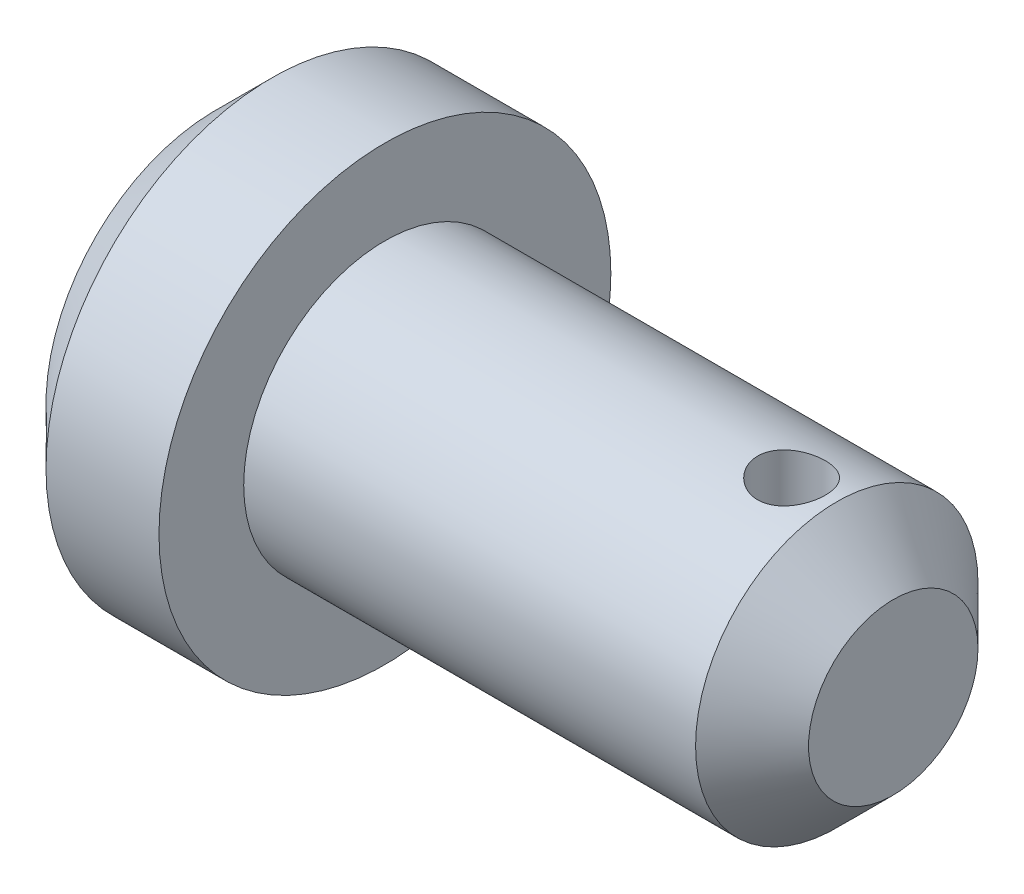
from build123d import *

# Parameters (mm, degrees)
SKETCH_2_W = 6
SKETCH_2_H = 84


with BuildPart() as part:
    # 草圖1 → 迴轉1 (revolve)
    with BuildSketch(Plane.XY, mode=Mode.PRIVATE) as revolve_1_sk:
        Polygon((0, 0), (-120, 0), (-120, 30), (-110, 40), (-90, 40), (-90, 25), (-10, 25), (0, 15), align=None)
    revolve(revolve_1_sk.sketch.rotate(Axis((0, 0, 0), (-1, 0, 0)), 90), axis=Axis((0, 0, 0), (-1, 0, 0)))

    # 草圖2 → 迴轉2 (revolve, cut)
    with BuildSketch(Plane.XY, mode=Mode.PRIVATE) as cut_revolve_2_sk:
        with Locations((-21, -9)):
            Rectangle(SKETCH_2_W, SKETCH_2_H)
    revolve(cut_revolve_2_sk.sketch.rotate(Axis((-18, -51, 0), (0, 1, 0)), 270), axis=Axis((-18, -51, 0), (0, 1, 0)), mode=Mode.SUBTRACT)


solid = part.part
